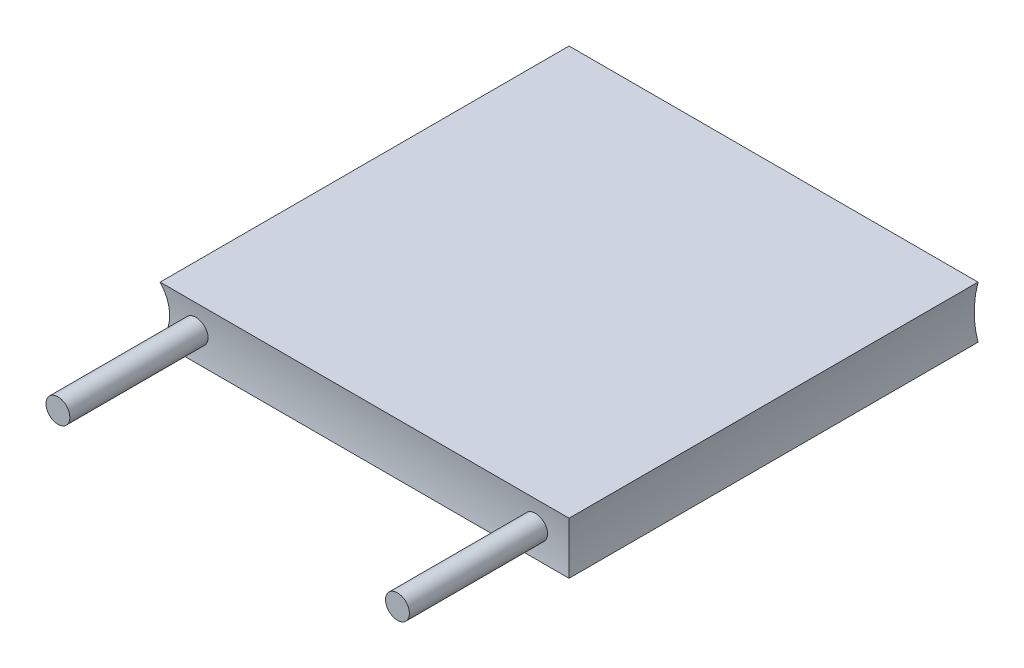
from build123d import *

# Parameters (mm, degrees)
SKETCH1_W                = 30
SKETCH1_H                = 30
BOSS_EXTRUDE1_DEPTH      = 3.82
CUT_EXTRUDE2_DEPTH       = 43.598032818
CUT_EXTRUDE5_DEPTH       = 45
BOSS_EXTRUDE2_DEPTH      = 10
BOSS_EXTRUDE2_DEPTH_BACK = 5
SKETCH4_R                = 0.875
BOSS_EXTRUDE3_DEPTH      = 10
BOSS_EXTRUDE3_DEPTH_BACK = 5
SKETCH5_R                = 0.875


with BuildPart() as part:
    # Sketch1 → Boss-Extrude1 (new body)
    with BuildSketch(Plane(origin=(0, 0, 0), x_dir=(1, 0, 0), z_dir=(0, 1, 0))):
        with Locations((15, 15)):
            Rectangle(SKETCH1_W, SKETCH1_H)
    extrude(amount=BOSS_EXTRUDE1_DEPTH)

    # Sketch2 → Cut-Extrude2 (cut, through all)
    with BuildSketch(Plane.XY):
        Polygon((-3, 1.91), (0, 1.91), (0, 3.82), align=None)
        with BuildLine():
            ThreePointArc((0, 3.82), (0.556416736, 1.91), (0, 0))
            Line((0, 0), (0, 3.82))
        make_face()
        Polygon((0, 0), (0, 1.91), (-3, 1.91), align=None)
        Polygon((30, 3.82), (30, 1.91), (43, 1.91), align=None)
        Polygon((43, 1.91), (30, 1.91), (30, 0), align=None)
        with BuildLine():
            ThreePointArc((30, 3.82), (29.860437602, 1.91), (30, 0))
            Line((30, 0), (30, 3.82))
        make_face()
    extrude(amount=-CUT_EXTRUDE2_DEPTH, mode=Mode.SUBTRACT)

    # Sketch3 → Cut-Extrude5 (cut)
    with BuildSketch(Plane(origin=(0, 0, 0), x_dir=(0, 0, -1), z_dir=(1, 0, 0))):
        with BuildLine():
            Line((30, 3.82), (43, 1.91))
            Line((43, 1.91), (30, 0))
            ThreePointArc((30, 0), (29.860437602, 1.91), (30, 3.82))
        make_face()
        with BuildLine():
            Line((0, 3.82), (-13, 1.91))
            Line((-13, 1.91), (0, 0))
            ThreePointArc((0, 0), (0.139562398, 1.91), (0, 3.82))
        make_face()
    extrude(amount=CUT_EXTRUDE5_DEPTH, mode=Mode.SUBTRACT)

    # Sketch4 → Boss-Extrude2 (add, two sides: drawn at the far end of the back side and taken through both)
    with BuildSketch(Plane.XY.offset(-BOSS_EXTRUDE2_DEPTH_BACK)):
        with Locations((2.5, 1.91)):
            Circle(SKETCH4_R)
    extrude(amount=BOSS_EXTRUDE2_DEPTH + BOSS_EXTRUDE2_DEPTH_BACK)

    # Sketch5 → Boss-Extrude3 (add, two sides: drawn at the far end of the back side and taken through both)
    with BuildSketch(Plane.XY.offset(-BOSS_EXTRUDE3_DEPTH_BACK)):
        with Locations((27.410666516, 1.91)):
            Circle(SKETCH5_R)
    extrude(amount=BOSS_EXTRUDE3_DEPTH + BOSS_EXTRUDE3_DEPTH_BACK)


solid = part.part
